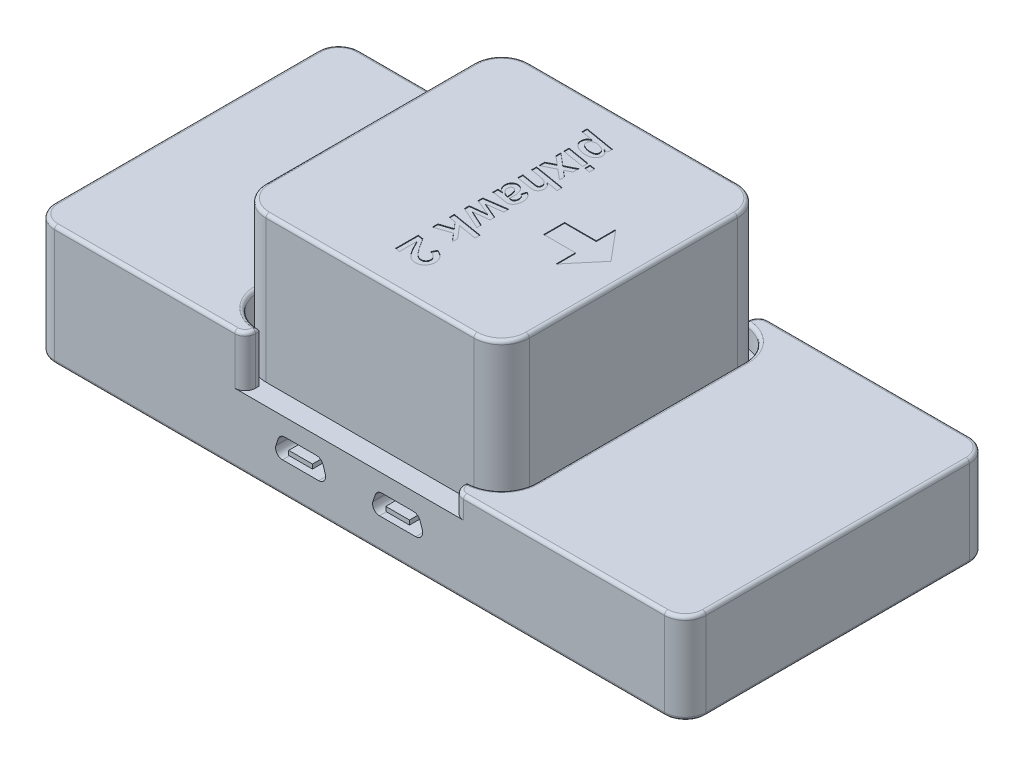
from build123d import *

# Parameters (mm, degrees)
BOSS_EXTRUDE1_DEPTH = 10
BOSS_EXTRUDE2_DEPTH = 3.1
BOSS_EXTRUDE3_DEPTH = 7.3
FILLET1_R           = 1.5
BOSS_EXTRUDE4_DEPTH = 21
FILLET2_R           = 0.5
SKETCH6_W           = 0.75
SKETCH6_H           = 0.75
CUT_EXTRUDE1_DEPTH  = 8
SKETCH7_W           = 4.55848156
SKETCH7_H           = 0.818087622
CUT_EXTRUDE2_DEPTH  = 5
SKETCH8_W           = 3.423616374
SKETCH8_H           = 0.632455532
CUT_EXTRUDE3_DEPTH  = 5
CUT_EXTRUDE4_DEPTH  = 0.1
SKETCH10_R          = 1.25
CUT_EXTRUDE5_DEPTH  = 4


with BuildPart() as part:
    # Sketch1 → Boss-Extrude1 (new body)
    with BuildSketch(Plane(origin=(0, 0, 0), x_dir=(1, 0, 0), z_dir=(0, 1, 0))):
        with BuildLine():
            Line((-44, 22), (44, 22))
            ThreePointArc((44, 22), (46.121320344, 21.121320344), (47, 19))
            Line((47, 19), (47, -19))
            ThreePointArc((47, -19), (46.121320344, -21.121320344), (44, -22))
            Line((44, -22), (-44, -22))
            ThreePointArc((-44, -22), (-46.121320344, -21.121320344), (-47, -19))
            Line((-47, -19), (-47, 19))
            ThreePointArc((-47, 19), (-46.121320344, 21.121320344), (-44, 22))
        make_face()
    extrude(amount=BOSS_EXTRUDE1_DEPTH)

    # Sketch3 → Boss-Extrude2 (add)
    with BuildSketch(Plane(origin=(0, 10, 0), x_dir=(1, 0, 0), z_dir=(0, 1, 0))):
        with BuildLine():
            Line((18.5, 15), (18.5, -15))
            ThreePointArc((18.5, -15), (17.035533906, -18.535533906), (13.5, -20))
            Line((13.5, -20), (13.5, -22))
            Line((13.5, -22), (44, -22))
            ThreePointArc((44, -22), (46.121320344, -21.121320344), (47, -19))
            Line((47, -19), (47, 19))
            ThreePointArc((47, 19), (46.121320344, 21.121320344), (44, 22))
            Line((44, 22), (13.5, 22))
            Line((13.5, 22), (13.5, 20))
            ThreePointArc((13.5, 20), (17.035533906, 18.535533906), (18.5, 15))
        make_face()
    extrude(amount=BOSS_EXTRUDE2_DEPTH)

    # Sketch4 → Boss-Extrude3 (add)
    with BuildSketch(Plane(origin=(0, 10, 0), x_dir=(1, 0, 0), z_dir=(0, 1, 0))):
        with BuildLine():
            Line((-21.5, 15), (-21.5, -15))
            ThreePointArc((-21.5, -15), (-20.035533906, -18.535533906), (-16.5, -20))
            Line((-16.5, -20), (-16.5, -22))
            Line((-16.5, -22), (-44, -22))
            ThreePointArc((-44, -22), (-46.121320344, -21.121320344), (-47, -19))
            Line((-47, -19), (-47, 19))
            ThreePointArc((-47, 19), (-46.121320344, 21.121320344), (-44, 22))
            Line((-44, 22), (-16.5, 22))
            Line((-16.5, 22), (-16.5, 20))
            ThreePointArc((-16.5, 20), (-20.035533906, 18.535533906), (-21.5, 15))
        make_face()
    extrude(amount=BOSS_EXTRUDE3_DEPTH)

    # Fillet1
    fillet1_edges = [part.edges().sort_by_distance(p)[0] for p in [
        (-16.5, 13.65, -22),
        (13.5, 11.55, -22),
        (13.5, 11.55, 22),
        (-16.5, 13.65, 22),
    ]]
    fillet(fillet1_edges, radius=FILLET1_R)

    # Sketch5 → Boss-Extrude4 (add)
    with BuildSketch(Plane(origin=(0, 10, 0), x_dir=(1, 0, 0), z_dir=(0, 1, 0))):
        with BuildLine():
            Line((-16.5, -19), (13.5, -19))
            ThreePointArc((13.5, -19), (16.328427125, -17.828427125), (17.5, -15))
            Line((17.5, -15), (17.5, 15))
            ThreePointArc((17.5, 15), (16.328427125, 17.828427125), (13.5, 19))
            Line((13.5, 19), (-16.5, 19))
            ThreePointArc((-16.5, 19), (-19.328427125, 17.828427125), (-20.5, 15))
            Line((-20.5, 15), (-20.5, -15))
            ThreePointArc((-20.5, -15), (-19.328427125, -17.828427125), (-16.5, -19))
        make_face()
    extrude(amount=BOSS_EXTRUDE4_DEPTH)

    # Fillet2
    fillet2_edges = [part.edges().sort_by_distance(p)[0] for p in [
        (0, 0, -22),
        (46.121320344, 0, -21.121320344),
        (-19.328427125, 31, 17.828427125),
        (-1.5, 31, 19),
        (16.328427125, 31, 17.828427125),
        (17.5, 31, 0),
        (16.328427125, 31, -17.828427125),
        (-1.5, 31, -19),
        (-19.328427125, 31, -17.828427125),
        (-20.5, 31, 0),
        (17.035533906, 13.1, -18.535533906),
        (18.5, 13.1, 0),
        (17.035533906, 13.1, 18.535533906),
        (13.5, 13.1, 20.25),
        (46.121320344, 13.1, 21.121320344),
        (47, 13.1, 0),
        (46.121320344, 13.1, -21.121320344),
        (29.5, 13.1, -22),
        (-20.035533906, 17.3, -18.535533906),
        (-16.5, 17.3, -20.25),
        (-46.121320344, 17.3, -21.121320344),
        (-47, 17.3, 0),
        (-46.121320344, 17.3, 21.121320344),
        (-31, 17.3, 22),
        (-20.035533906, 17.3, 18.535533906),
        (-21.5, 17.3, 0),
        (47, 0, 0),
        (-31, 17.3, -22),
        (46.121320344, 0, 21.121320344),
        (-16.5, 17.3, 20.25),
        (-16.939339828, 17.3, 21.560660172),
        (-16.939339828, 17.3, -21.560660172),
        (0, 0, 22),
        (13.5, 13.1, -20.25),
        (29.5, 13.1, 22),
        (13.939339828, 13.1, 21.560660172),
        (13.939339828, 13.1, -21.560660172),
        (-46.121320344, 0, 21.121320344),
        (-47, 0, 0),
        (-46.121320344, 0, -21.121320344),
    ]]
    fillet(fillet2_edges, radius=FILLET2_R)

    # Sketch6 → Cut-Extrude1 (cut)
    with BuildSketch(Plane.ZY.offset(47)):
        Polygon((-19, 16), (-19, 7.2), (-18, 7.2), (-18, 8), (-17, 8), (-17, 7.2), (-16, 7.2), (-16, 8), (-15, 8), (-15, 7.2), (-14, 7.2), (-14, 8), (-13, 8), (-13, 7.2), (-12, 7.2), (-12, 8), (-11, 8), (-11, 7.2), (-10, 7.2), (-10, 8), (-9, 8), (-9, 7.2), (-8, 7.2), (-8, 8), (-7, 8), (-7, 7.2), (-6, 7.2), (-6, 8), (-5, 8), (-5, 7.2), (-4, 7.2), (-4, 8), (-3, 8), (-3, 7.2), (-2, 7.2), (-2, 8), (-1, 8), (-1, 7.2), (0, 7.2), (0, 8), (1, 8), (1, 7.2), (2, 7.2), (2, 8), (3, 8), (3, 7.2), (4, 7.2), (4, 8), (5, 8), (5, 7.2), (6, 7.2), (6, 8), (7, 8), (7, 7.2), (8, 7.2), (8, 8), (9, 8), (9, 7.2), (10, 7.2), (10, 8), (11, 8), (11, 7.2), (12, 7.2), (12, 8), (13, 8), (13, 7.2), (14, 7.2), (14, 8), (15, 8), (15, 7.2), (16, 7.2), (16, 8), (17, 8), (17, 7.2), (18, 7.2), (18, 8), (19, 8), (19, 16), (17, 16), (15, 16), (13, 16), (11, 16), (9, 16), (7, 16), (5, 16), (3, 16), (1, 16), (-1, 16), (-3, 16), (-5, 16), (-7, 16), (-9, 16), (-11, 16), (-13, 16), (-15, 16), (-17, 16), align=None)
        with Locations((-18, 14.5)):
            Rectangle(SKETCH6_W, SKETCH6_H, mode=Mode.SUBTRACT)
        with Locations((-18, 12)):
            Rectangle(SKETCH6_W, SKETCH6_H, mode=Mode.SUBTRACT)
        with Locations((-18, 9.5)):
            Rectangle(SKETCH6_W, SKETCH6_H, mode=Mode.SUBTRACT)
        with Locations((-16, 14.5)):
            Rectangle(SKETCH6_W, SKETCH6_H, mode=Mode.SUBTRACT)
        with Locations((-16, 12)):
            Rectangle(SKETCH6_W, SKETCH6_H, mode=Mode.SUBTRACT)
        with Locations((-16, 9.5)):
            Rectangle(SKETCH6_W, SKETCH6_H, mode=Mode.SUBTRACT)
        with Locations((-14, 14.5)):
            Rectangle(SKETCH6_W, SKETCH6_H, mode=Mode.SUBTRACT)
        with Locations((-14, 12)):
            Rectangle(SKETCH6_W, SKETCH6_H, mode=Mode.SUBTRACT)
        with Locations((-14, 9.5)):
            Rectangle(SKETCH6_W, SKETCH6_H, mode=Mode.SUBTRACT)
        with Locations((-12, 14.5)):
            Rectangle(SKETCH6_W, SKETCH6_H, mode=Mode.SUBTRACT)
        with Locations((-12, 12)):
            Rectangle(SKETCH6_W, SKETCH6_H, mode=Mode.SUBTRACT)
        with Locations((-12, 9.5)):
            Rectangle(SKETCH6_W, SKETCH6_H, mode=Mode.SUBTRACT)
        with Locations((-10, 14.5)):
            Rectangle(SKETCH6_W, SKETCH6_H, mode=Mode.SUBTRACT)
        with Locations((-10, 12)):
            Rectangle(SKETCH6_W, SKETCH6_H, mode=Mode.SUBTRACT)
        with Locations((-10, 9.5)):
            Rectangle(SKETCH6_W, SKETCH6_H, mode=Mode.SUBTRACT)
        with Locations((-8, 14.5)):
            Rectangle(SKETCH6_W, SKETCH6_H, mode=Mode.SUBTRACT)
        with Locations((-8, 12)):
            Rectangle(SKETCH6_W, SKETCH6_H, mode=Mode.SUBTRACT)
        with Locations((-8, 9.5)):
            Rectangle(SKETCH6_W, SKETCH6_H, mode=Mode.SUBTRACT)
        with Locations((-6, 14.5)):
            Rectangle(SKETCH6_W, SKETCH6_H, mode=Mode.SUBTRACT)
        with Locations((-6, 12)):
            Rectangle(SKETCH6_W, SKETCH6_H, mode=Mode.SUBTRACT)
        with Locations((-6, 9.5)):
            Rectangle(SKETCH6_W, SKETCH6_H, mode=Mode.SUBTRACT)
        with Locations((-4, 14.5)):
            Rectangle(SKETCH6_W, SKETCH6_H, mode=Mode.SUBTRACT)
        with Locations((-4, 12)):
            Rectangle(SKETCH6_W, SKETCH6_H, mode=Mode.SUBTRACT)
        with Locations((-4, 9.5)):
            Rectangle(SKETCH6_W, SKETCH6_H, mode=Mode.SUBTRACT)
        with Locations((-2, 14.5)):
            Rectangle(SKETCH6_W, SKETCH6_H, mode=Mode.SUBTRACT)
        with Locations((-2, 12)):
            Rectangle(SKETCH6_W, SKETCH6_H, mode=Mode.SUBTRACT)
        with Locations((-2, 9.5)):
            Rectangle(SKETCH6_W, SKETCH6_H, mode=Mode.SUBTRACT)
        with Locations((0, 14.5)):
            Rectangle(SKETCH6_W, SKETCH6_H, mode=Mode.SUBTRACT)
        with Locations((0, 12)):
            Rectangle(SKETCH6_W, SKETCH6_H, mode=Mode.SUBTRACT)
        with Locations((0, 9.5)):
            Rectangle(SKETCH6_W, SKETCH6_H, mode=Mode.SUBTRACT)
        with Locations((2, 14.5)):
            Rectangle(SKETCH6_W, SKETCH6_H, mode=Mode.SUBTRACT)
        with Locations((2, 12)):
            Rectangle(SKETCH6_W, SKETCH6_H, mode=Mode.SUBTRACT)
        with Locations((2, 9.5)):
            Rectangle(SKETCH6_W, SKETCH6_H, mode=Mode.SUBTRACT)
        with Locations((4, 14.5)):
            Rectangle(SKETCH6_W, SKETCH6_H, mode=Mode.SUBTRACT)
        with Locations((4, 12)):
            Rectangle(SKETCH6_W, SKETCH6_H, mode=Mode.SUBTRACT)
        with Locations((4, 9.5)):
            Rectangle(SKETCH6_W, SKETCH6_H, mode=Mode.SUBTRACT)
        with Locations((6, 14.5)):
            Rectangle(SKETCH6_W, SKETCH6_H, mode=Mode.SUBTRACT)
        with Locations((6, 12)):
            Rectangle(SKETCH6_W, SKETCH6_H, mode=Mode.SUBTRACT)
        with Locations((6, 9.5)):
            Rectangle(SKETCH6_W, SKETCH6_H, mode=Mode.SUBTRACT)
        with Locations((8, 14.5)):
            Rectangle(SKETCH6_W, SKETCH6_H, mode=Mode.SUBTRACT)
        with Locations((8, 12)):
            Rectangle(SKETCH6_W, SKETCH6_H, mode=Mode.SUBTRACT)
        with Locations((8, 9.5)):
            Rectangle(SKETCH6_W, SKETCH6_H, mode=Mode.SUBTRACT)
        with Locations((10, 14.5)):
            Rectangle(SKETCH6_W, SKETCH6_H, mode=Mode.SUBTRACT)
        with Locations((10, 12)):
            Rectangle(SKETCH6_W, SKETCH6_H, mode=Mode.SUBTRACT)
        with Locations((10, 9.5)):
            Rectangle(SKETCH6_W, SKETCH6_H, mode=Mode.SUBTRACT)
        with Locations((12, 14.5)):
            Rectangle(SKETCH6_W, SKETCH6_H, mode=Mode.SUBTRACT)
        with Locations((12, 12)):
            Rectangle(SKETCH6_W, SKETCH6_H, mode=Mode.SUBTRACT)
        with Locations((12, 9.5)):
            Rectangle(SKETCH6_W, SKETCH6_H, mode=Mode.SUBTRACT)
        with Locations((14, 14.5)):
            Rectangle(SKETCH6_W, SKETCH6_H, mode=Mode.SUBTRACT)
        with Locations((14, 12)):
            Rectangle(SKETCH6_W, SKETCH6_H, mode=Mode.SUBTRACT)
        with Locations((14, 9.5)):
            Rectangle(SKETCH6_W, SKETCH6_H, mode=Mode.SUBTRACT)
        with Locations((16, 14.5)):
            Rectangle(SKETCH6_W, SKETCH6_H, mode=Mode.SUBTRACT)
        with Locations((16, 12)):
            Rectangle(SKETCH6_W, SKETCH6_H, mode=Mode.SUBTRACT)
        with Locations((16, 9.5)):
            Rectangle(SKETCH6_W, SKETCH6_H, mode=Mode.SUBTRACT)
        with Locations((18, 14.5)):
            Rectangle(SKETCH6_W, SKETCH6_H, mode=Mode.SUBTRACT)
        with Locations((18, 12)):
            Rectangle(SKETCH6_W, SKETCH6_H, mode=Mode.SUBTRACT)
        with Locations((18, 9.5)):
            Rectangle(SKETCH6_W, SKETCH6_H, mode=Mode.SUBTRACT)
    extrude(amount=-CUT_EXTRUDE1_DEPTH, mode=Mode.SUBTRACT)

    # Sketch7 → Cut-Extrude2 (cut)
    with BuildSketch(Plane(origin=(0, 0, -19), x_dir=(-1, 0, 0), z_dir=(0, 0, -1))):
        with BuildLine():
            Line((3.77924078, 14), (-0.77924078, 14))
            ThreePointArc((-0.77924078, 14), (-1.363951065, 14.188757815), (-1.727924078, 14.683772234))
            Line((-1.727924078, 14.683772234), (-2.061257411, 15.683772234))
            ThreePointArc((-2.061257411, 15.683772234), (-1.923816298, 16.584710285), (-1.112574113, 17))
            Line((-1.112574113, 17), (4.112574113, 17))
            ThreePointArc((4.112574113, 17), (4.923816298, 16.584710285), (5.061257411, 15.683772234))
            Line((5.061257411, 15.683772234), (4.727924078, 14.683772234))
            ThreePointArc((4.727924078, 14.683772234), (4.363951065, 14.188757815), (3.77924078, 14))
        make_face()
        with Locations((1.5, 15.2670152)):
            Rectangle(SKETCH7_W, SKETCH7_H, mode=Mode.SUBTRACT)
    extrude(amount=-CUT_EXTRUDE2_DEPTH, mode=Mode.SUBTRACT)

    # Sketch8 → Cut-Extrude3 (cut)
    # profile 1 of 2: a face of its own
    with BuildSketch(Plane.XY.offset(22)):
        with BuildLine():
            Line((-6.22075922, 7.5), (-10.77924078, 7.5))
            ThreePointArc((-10.77924078, 7.5), (-11.363951065, 7.311242185), (-11.727924078, 6.816227766))
            Line((-11.727924078, 6.816227766), (-12.061257411, 5.816227766))
            ThreePointArc((-12.061257411, 5.816227766), (-11.923816298, 4.915289715), (-11.112574113, 4.5))
            Line((-11.112574113, 4.5), (-5.887425887, 4.5))
            ThreePointArc((-5.887425887, 4.5), (-5.076183702, 4.915289715), (-4.938742589, 5.816227766))
            Line((-4.938742589, 5.816227766), (-5.272075922, 6.816227766))
            ThreePointArc((-5.272075922, 6.816227766), (-5.636048935, 7.311242185), (-6.22075922, 7.5))
        make_face()
        with Locations((-8.5, 5.816227766)):
            Rectangle(SKETCH8_W, SKETCH8_H, mode=Mode.SUBTRACT)
    # profile 2 of 2: a face of its own
    with BuildSketch(Plane.XY.offset(22)):
        with BuildLine():
            Line((2.272075922, 6.816227766), (1.938742589, 5.816227766))
            ThreePointArc((1.938742589, 5.816227766), (2.076183702, 4.915289715), (2.887425887, 4.5))
            Line((2.887425887, 4.5), (8.112574113, 4.5))
            ThreePointArc((8.112574113, 4.5), (8.923816298, 4.915289715), (9.061257411, 5.816227766))
            Line((9.061257411, 5.816227766), (8.727924078, 6.816227766))
            ThreePointArc((8.727924078, 6.816227766), (8.363951065, 7.311242185), (7.77924078, 7.5))
            Line((7.77924078, 7.5), (3.22075922, 7.5))
            ThreePointArc((3.22075922, 7.5), (2.636048935, 7.311242185), (2.272075922, 6.816227766))
        make_face()
        with Locations((5.5, 5.816227766)):
            Rectangle(SKETCH8_W, SKETCH8_H, mode=Mode.SUBTRACT)
    extrude(amount=-CUT_EXTRUDE3_DEPTH, mode=Mode.SUBTRACT)

    # Sketch9 → Cut-Extrude4 (cut)
    # profile 1 of 10: a face of its own
    with BuildSketch(Plane(origin=(0, 31, 0), x_dir=(1, 0, 0), z_dir=(0, 1, 0))):
        Polygon((14.278659866, 0), (10.656792996, 4.316372855), (10.656792996, 1.5), (6.089467314, 1.5), (6.089467314, -1.5), (10.656792996, -1.5), (10.656792996, -4.316372855), align=None)
    # profile 2 of 10: a face of its own
    with BuildSketch(Plane(origin=(0, 31, 0), x_dir=(1, 0, 0), z_dir=(0, 1, 0))):
        with BuildLine():
            Line((-3.987484441, 14.100467933), (-3.987484441, 14.828964326))
            Line((-3.987484441, 14.828964326), (0.397002456, 14.085994495))
            Line((0.397002456, 14.085994495), (0.397002456, 13.420216335))
            Line((0.397002456, 13.420216335), (-0.295792788, 13.537933633))
            add(Edge.make_bspline(
                [(-0.295792788, 13.537933633), (-0.231453657, 13.503682228), (-0.108184623, 13.438059063), (0.058909692, 13.32567937), (0.201299382, 13.207262183), (0.317948782, 13.081211697), (0.408142459, 12.947696459), (0.472939852, 12.807787971), (0.513740713, 12.660880785), (0.518241979, 12.560109868), (0.52050913, 12.50935462)],
                knots=[0, 0, 0, 0, 1.261498847, 2.416938787, 3.480176131, 4.461740898, 5.380832901, 6.257997024, 7.122606052, 8, 8, 8, 8], degree=3))
            add(Edge.make_bspline(
                [(0.52050913, 12.50935462), (0.519446385, 12.471333166), (0.517363307, 12.39680762), (0.499542126, 12.288003054), (0.470491432, 12.184696444), (0.429795216, 12.086814268), (0.377470372, 11.994074175), (0.311719122, 11.908279398), (0.236337071, 11.826562387), (0.149462614, 11.751705567), (0.052837835, 11.684090373), (-0.052951901, 11.625142482), (-0.166674576, 11.575098059), (-0.288527096, 11.534543369), (-0.418171796, 11.502492098), (-0.556384173, 11.481028407), (-0.702375324, 11.467155088), (-0.802330046, 11.465314619), (-0.85350261, 11.464372377)],
                knots=[0, 0, 0, 0, 0.941970943, 1.846349639, 2.724628806, 3.596698408, 4.467892951, 5.356031433, 6.269918392, 7.219416619, 8.192584869, 9.188414247, 10.21646559, 11.267778751, 12.368013318, 13.522733717, 14.7317451, 16, 16, 16, 16], degree=3))
            add(Edge.make_bspline(
                [(-0.85350261, 11.464372377), (-0.918194471, 11.465398917), (-1.046556642, 11.467435786), (-1.236768166, 11.486339355), (-1.422823464, 11.517040461), (-1.604482047, 11.560905371), (-1.782362562, 11.615540081), (-1.955791013, 11.683472842), (-2.124666898, 11.764118475), (-2.288166607, 11.853933956), (-2.439110444, 11.954307721), (-2.571914953, 12.064100413), (-2.684927683, 12.181110201), (-2.778011668, 12.30619162), (-2.848944967, 12.440216012), (-2.900833342, 12.580869081), (-2.931341166, 12.729660159), (-2.935542239, 12.831170039), (-2.937677719, 12.882769327)],
                knots=[0, 0, 0, 0, 1.116727311, 2.215820355, 3.296777593, 4.37030568, 5.440034981, 6.50739762, 7.583006455, 8.669342543, 9.725945833, 10.707890216, 11.638757248, 12.528443272, 13.39052447, 14.2478705, 15.109361226, 16, 16, 16, 16], degree=3))
            add(Edge.make_bspline(
                [(-2.937677719, 12.882769327), (-2.935798395, 12.937301252), (-2.932149666, 13.043175627), (-2.899456239, 13.19476041), (-2.847688789, 13.333740555), (-2.771709088, 13.457476204), (-2.676121794, 13.568821523), (-2.556708727, 13.662933305), (-2.418870219, 13.746702432), (-2.315738805, 13.78713466), (-2.2622506, 13.80810448)],
                knots=[0, 0, 0, 0, 1.060630692, 2.059226998, 3.004807098, 3.934934718, 4.871680154, 5.846828231, 6.883276337, 8, 8, 8, 8], degree=3))
            Line((-2.2622506, 13.80810448), (-3.987484441, 14.100467933))
        make_face()
        with BuildLine():
            add(Edge.make_bspline(
                [(-2.320144354, 13.019784543), (-2.31906498, 12.988116026), (-2.316933124, 12.925567986), (-2.293363711, 12.83513287), (-2.257693706, 12.749790647), (-2.206436878, 12.670756888), (-2.140856764, 12.597726359), (-2.060487592, 12.531436211), (-1.96715813, 12.468830388), (-1.823227662, 12.39654382), (-1.632543402, 12.320544218), (-1.396689029, 12.25473852), (-1.157614718, 12.213326846), (-0.99679256, 12.208054071), (-0.916220842, 12.205412416)],
                knots=[0, 0, 0, 0, 0.639127482, 1.262331674, 1.877333655, 2.503484616, 3.157695573, 3.854838522, 4.605385696, 5.425858387, 7.107357241, 8.748831193, 10.371168137, 12, 12, 12, 12], degree=3))
            add(Edge.make_bspline(
                [(-0.916220842, 12.205412416), (-0.88307117, 12.205610189), (-0.818948527, 12.205992749), (-0.726039702, 12.213822155), (-0.639342766, 12.221781383), (-0.55953415, 12.238699051), (-0.485482583, 12.255559601), (-0.418311013, 12.279472012), (-0.356918314, 12.306122983), (-0.302318593, 12.337714539), (-0.253863262, 12.373345482), (-0.210923228, 12.412234859), (-0.176334259, 12.457656753), (-0.146807675, 12.505899271), (-0.124824929, 12.558768924), (-0.108045672, 12.615267466), (-0.098402789, 12.676271842), (-0.097491365, 12.7183821), (-0.097024236, 12.739964736)],
                knots=[0, 0, 0, 0, 1.435559759, 2.776856611, 4.038710643, 5.202916836, 6.308082838, 7.32608991, 8.286786172, 9.204583877, 10.051863807, 10.889926384, 11.703893209, 12.516427414, 13.334321008, 14.176543877, 15.065429821, 16, 16, 16, 16], degree=3))
            add(Edge.make_bspline(
                [(-0.097024236, 12.739964736), (-0.098687905, 12.772864305), (-0.102000635, 12.838374602), (-0.123098196, 12.934536141), (-0.161221049, 13.025792254), (-0.212447314, 13.11313751), (-0.279683983, 13.195974253), (-0.360536501, 13.274783082), (-0.456977015, 13.348539217), (-0.565116882, 13.417323272), (-0.68122649, 13.479803526), (-0.800508733, 13.535080045), (-0.921177328, 13.582608217), (-1.043579642, 13.621456204), (-1.167941874, 13.65018567), (-1.293599008, 13.671273813), (-1.420845132, 13.685777336), (-1.506375771, 13.686920317), (-1.549192542, 13.687492495)],
                knots=[0, 0, 0, 0, 0.833056023, 1.658798261, 2.476796725, 3.327219383, 4.213524387, 5.169324243, 6.179089722, 7.281299713, 8.410692177, 9.514494936, 10.607675836, 11.691813598, 12.762258901, 13.835796373, 14.916596293, 16, 16, 16, 16], degree=3))
            add(Edge.make_bspline(
                [(-1.549192542, 13.687492495), (-1.578168433, 13.687039337), (-1.635003478, 13.686150486), (-1.717600805, 13.676216441), (-1.795678784, 13.660736982), (-1.868794102, 13.639845754), (-1.937456402, 13.612586729), (-2.001002532, 13.578678137), (-2.060653475, 13.539119832), (-2.130728136, 13.47792129), (-2.207260838, 13.394298265), (-2.271606731, 13.27809992), (-2.313905191, 13.152613085), (-2.318043388, 13.064513014), (-2.320144354, 13.019784543)],
                knots=[0, 0, 0, 0, 0.912891304, 1.790599611, 2.617669246, 3.419758295, 4.184055822, 4.941396756, 5.686493576, 6.43420647, 7.870458793, 9.232260465, 10.594816598, 12, 12, 12, 12], degree=3))
        make_face(mode=Mode.SUBTRACT)
    # profile 3 of 10: a face of its own
    with BuildSketch(Plane(origin=(0, 31, 0), x_dir=(1, 0, 0), z_dir=(0, 1, 0))):
        Polygon((0.767522476, 9.734314057), (0.767522476, 10.500441389), (1.570315852, 10.365355965), (1.570315852, 9.599228633), align=None)
    # profile 4 of 10: a face of its own
    with BuildSketch(Plane(origin=(0, 31, 0), x_dir=(1, 0, 0), z_dir=(0, 1, 0))):
        Polygon((-2.875924383, 10.345093152), (-2.875924383, 11.109290692), (0.397002456, 10.562194726), (0.397002456, 9.797997185), align=None)
    # profile 5 of 10: a face of its own
    with BuildSketch(Plane(origin=(0, 31, 0), x_dir=(1, 0, 0), z_dir=(0, 1, 0))):
        Polygon((-2.875924383, 6.771118797), (-2.875924383, 7.603823945), (-1.679453486, 8.202059393), (-2.875924383, 9.21327028), (-2.875924383, 9.93983688), (-1.139111791, 8.472230241), (0.397002456, 9.24125226), (0.397002456, 8.408547112), (-0.521578425, 7.949256671), (0.397002456, 7.172515484), (0.397002456, 6.44691378), (-1.061920121, 7.679085824), align=None)
    # profile 6 of 10: a face of its own
    with BuildSketch(Plane(origin=(0, 31, 0), x_dir=(1, 0, 0), z_dir=(0, 1, 0))):
        with BuildLine():
            Line((-2.875924383, 3.712398844), (-2.875924383, 4.43993034))
            Line((-2.875924383, 4.43993034), (-0.985693346, 4.124409386))
            add(Edge.make_bspline(
                [(-0.985693346, 4.124409386), (-0.959653784, 4.11982975), (-0.909866341, 4.111073521), (-0.839363476, 4.099897661), (-0.776727767, 4.089656269), (-0.722216673, 4.082738459), (-0.675481184, 4.074804835), (-0.636699183, 4.071928478), (-0.605908282, 4.068200713), (-0.588163639, 4.067698993), (-0.580437074, 4.067480529)],
                knots=[0, 0, 0, 0, 1.549606308, 2.962835416, 4.183966133, 5.269029581, 6.183469928, 6.960048383, 7.547172991, 8, 8, 8, 8], degree=3))
            add(Edge.make_bspline(
                [(-0.580437074, 4.067480529), (-0.547501877, 4.068592018), (-0.485109247, 4.070697629), (-0.398165023, 4.091189326), (-0.322959009, 4.123792119), (-0.261923538, 4.172309829), (-0.213728914, 4.234289035), (-0.181487007, 4.310406031), (-0.16223426, 4.39909636), (-0.159975942, 4.462336263), (-0.158777573, 4.495894302)],
                knots=[0, 0, 0, 0, 1.145435513, 2.169919679, 3.09248482, 3.977837671, 4.856287774, 5.799306021, 6.832209241, 8, 8, 8, 8], degree=3))
            add(Edge.make_bspline(
                [(-0.158777573, 4.495894302), (-0.159516045, 4.520381802), (-0.160981942, 4.568990469), (-0.172971654, 4.641573938), (-0.193479425, 4.712925492), (-0.221627079, 4.783703189), (-0.257673172, 4.853369118), (-0.30123281, 4.922415544), (-0.353923552, 4.989616493), (-0.413536461, 5.057071932), (-0.484349259, 5.120948424), (-0.567389705, 5.18035597), (-0.663459294, 5.233929911), (-0.771988256, 5.28303434), (-0.893037401, 5.327107293), (-1.026363375, 5.366718454), (-1.172557277, 5.399971781), (-1.274441199, 5.418419078), (-1.327266489, 5.427983726)],
                knots=[0, 0, 0, 0, 0.719827964, 1.428887327, 2.156441309, 2.899386918, 3.665044384, 4.460106855, 5.296300213, 6.173684546, 7.104501426, 8.094061489, 9.169860714, 10.333850251, 11.59365571, 12.955293849, 14.421365427, 16, 16, 16, 16], degree=3))
            Line((-1.327266489, 5.427983726), (-2.875924383, 5.688505615))
            Line((-2.875924383, 5.688505615), (-2.875924383, 6.416037111))
            Line((-2.875924383, 6.416037111), (1.570315852, 5.67306728))
            Line((1.570315852, 5.67306728), (1.570315852, 4.945535784))
            Line((1.570315852, 4.945535784), (-0.21570643, 5.243688612))
            add(Edge.make_bspline(
                [(-0.21570643, 5.243688612), (-0.162186205, 5.20939588), (-0.058799757, 5.143151694), (0.078614575, 5.029419518), (0.19589392, 4.910652903), (0.291309851, 4.785044892), (0.367540157, 4.654048306), (0.419241915, 4.515256151), (0.452916835, 4.37109872), (0.456797815, 4.272548132), (0.458755793, 4.222828767)],
                knots=[0, 0, 0, 0, 1.18900067, 2.296824362, 3.331481453, 4.306909765, 5.242674338, 6.157398121, 7.070396251, 8, 8, 8, 8], degree=3))
            add(Edge.make_bspline(
                [(0.458755793, 4.222828767), (0.45840529, 4.191913928), (0.45771666, 4.131175911), (0.446166458, 4.041927583), (0.430169888, 3.956432805), (0.408126476, 3.874139949), (0.377775403, 3.795875451), (0.341435652, 3.720907447), (0.298334026, 3.649629148), (0.249527683, 3.582354796), (0.194014062, 3.519551932), (0.128378599, 3.466908815), (0.056642599, 3.420663963), (-0.023529855, 3.384320646), (-0.110738255, 3.355014346), (-0.205697998, 3.335557988), (-0.307963229, 3.322316486), (-0.378727282, 3.321219984), (-0.415439878, 3.320651115)],
                knots=[0, 0, 0, 0, 1.039889856, 2.04305932, 3.024074512, 3.967009926, 4.906021226, 5.845406958, 6.768237509, 7.705937122, 8.64107052, 9.579582347, 10.528713198, 11.507215876, 12.534345864, 13.619469254, 14.76497377, 16, 16, 16, 16], degree=3))
            add(Edge.make_bspline(
                [(-0.415439878, 3.320651115), (-0.427671086, 3.32080688), (-0.455400427, 3.321160015), (-0.501304793, 3.326003217), (-0.556432157, 3.330075744), (-0.620433387, 3.338188865), (-0.693278537, 3.349298657), (-0.775494391, 3.360188522), (-0.866072831, 3.37517587), (-0.929407894, 3.385623691), (-0.962535844, 3.391088514)],
                knots=[0, 0, 0, 0, 0.53156046, 1.205099444, 2.00522489, 2.934897165, 4.008724139, 5.209115947, 6.540204076, 8, 8, 8, 8], degree=3))
            Line((-0.962535844, 3.391088514), (-2.875924383, 3.712398844))
        make_face()
    # profile 7 of 10: a face of its own
    with BuildSketch(Plane(origin=(0, 31, 0), x_dir=(1, 0, 0), z_dir=(0, 1, 0))):
        with BuildLine():
            Line((-2.875924383, 0.089214799), (-2.875924383, 0.836044213))
            add(Edge.make_bspline(
                [(-2.875924383, 0.836044213), (-2.849238997, 0.837874799), (-2.801362584, 0.841159064), (-2.753388954, 0.842295483), (-2.732154896, 0.842798484)],
                knots=[0, 0, 0, 0, 1.114761245, 2, 2, 2, 2], degree=3))
            add(Edge.make_bspline(
                [(-2.732154896, 0.842798484), (-2.69064695, 0.841900635), (-2.603333217, 0.84001197), (-2.466797435, 0.828961094), (-2.318405513, 0.810499057), (-2.216193079, 0.793045689), (-2.162866324, 0.783939835)],
                knots=[0, 0, 0, 0, 0.869332553, 1.828678081, 2.867167654, 4, 4, 4, 4], degree=3))
            add(Edge.make_bspline(
                [(-2.162866324, 0.783939835), (-2.221886809, 0.812039034), (-2.337183916, 0.866931099), (-2.493407654, 0.972908431), (-2.627048129, 1.098196628), (-2.739263879, 1.238787058), (-2.827209638, 1.393127131), (-2.891407245, 1.555747478), (-2.930775651, 1.726712909), (-2.935355324, 1.843188368), (-2.937677719, 1.902254165)],
                knots=[0, 0, 0, 0, 1.085713933, 2.120953026, 3.123526653, 4.120652363, 5.100275414, 6.065460536, 7.018976904, 8, 8, 8, 8], degree=3))
            add(Edge.make_bspline(
                [(-2.937677719, 1.902254165), (-2.937069245, 1.93767599), (-2.935881392, 2.006825874), (-2.922730815, 2.107831653), (-2.902610309, 2.203715427), (-2.874870213, 2.295100545), (-2.837719113, 2.381133469), (-2.793674595, 2.462821872), (-2.739814331, 2.538286191), (-2.679412911, 2.608396618), (-2.612854037, 2.672060299), (-2.541964403, 2.727993752), (-2.466422833, 2.774950042), (-2.387539384, 2.813415743), (-2.304818, 2.843826426), (-2.218321755, 2.864532166), (-2.12829838, 2.879083259), (-2.066758528, 2.880127952), (-2.035500068, 2.880658592)],
                knots=[0, 0, 0, 0, 1.140923943, 2.227292263, 3.276277673, 4.295919007, 5.298988339, 6.291667912, 7.280932385, 8.280407149, 9.270105939, 10.244653848, 11.185148044, 12.130825634, 13.068631472, 14.01889907, 14.993722548, 16, 16, 16, 16], degree=3))
            add(Edge.make_bspline(
                [(-2.035500068, 2.880658592), (-1.992609814, 2.879255065), (-1.908430778, 2.876500418), (-1.786176398, 2.852498468), (-1.670538622, 2.814725907), (-1.561685909, 2.761198957), (-1.459573726, 2.691882437), (-1.364431749, 2.607039412), (-1.276701512, 2.506783786), (-1.19509918, 2.39200967), (-1.121140988, 2.261226675), (-1.059612472, 2.112321033), (-1.004725442, 1.947509514), (-0.962908693, 1.764719068), (-0.927547227, 1.565496878), (-0.904490342, 1.348847839), (-0.889754742, 1.115106705), (-0.888119959, 0.953464644), (-0.887273965, 0.869815569)],
                knots=[0, 0, 0, 0, 0.79484378, 1.560009057, 2.301387339, 3.045735746, 3.801871518, 4.583623495, 5.403525375, 6.267594815, 7.19178334, 8.183454721, 9.251193574, 10.410188063, 11.65770248, 13.002268198, 14.448686605, 16, 16, 16, 16], degree=3))
            add(Edge.make_bspline(
                [(-0.887273965, 0.869815569), (-0.887821645, 0.821554619), (-0.889005553, 0.717229802), (-0.896038257, 0.613131462), (-0.899817612, 0.557189302)],
                knots=[0, 0, 0, 0, 0.925205544, 2, 2, 2, 2], degree=3))
            add(Edge.make_bspline(
                [(-0.899817612, 0.557189302), (-0.875377137, 0.553960952), (-0.829106218, 0.54784901), (-0.76392695, 0.539428646), (-0.706552104, 0.535843915), (-0.671139297, 0.534605504), (-0.654734057, 0.534031801)],
                knots=[0, 0, 0, 0, 1.201025736, 2.273792282, 3.20032175, 4, 4, 4, 4], degree=3))
            add(Edge.make_bspline(
                [(-0.654734057, 0.534031801), (-0.616196206, 0.536115378), (-0.5423014, 0.540110555), (-0.438520179, 0.574590559), (-0.350680101, 0.633725208), (-0.280054969, 0.714710114), (-0.226150865, 0.811687107), (-0.186082707, 0.920000628), (-0.162806128, 1.039617333), (-0.160154269, 1.122836093), (-0.158777573, 1.166038605)],
                knots=[0, 0, 0, 0, 1.021073586, 1.957868208, 2.862363448, 3.799624756, 4.782287884, 5.792489705, 6.853984467, 8, 8, 8, 8], degree=3))
            add(Edge.make_bspline(
                [(-0.158777573, 1.166038605), (-0.159953389, 1.20761693), (-0.162248538, 1.28877623), (-0.18360782, 1.406122816), (-0.219943271, 1.514653443), (-0.268877438, 1.615054843), (-0.333742897, 1.705992631), (-0.412911755, 1.787244551), (-0.505358051, 1.860897565), (-0.575317637, 1.900308957), (-0.611313743, 1.920587187)],
                knots=[0, 0, 0, 0, 1.071934182, 2.09237458, 3.063201199, 4.016856354, 4.963082905, 5.931317666, 6.935606801, 8, 8, 8, 8], degree=3))
            Line((-0.611313743, 1.920587187), (-0.405790919, 2.571891909))
            add(Edge.make_bspline(
                [(-0.405790919, 2.571891909), (-0.370494699, 2.554326136), (-0.301361476, 2.519920795), (-0.202975094, 2.461333792), (-0.111426996, 2.398172395), (-0.027161818, 2.328828054), (0.051369864, 2.256101889), (0.121817786, 2.176949286), (0.18703155, 2.094479349), (0.243663708, 2.00567051), (0.295470221, 1.91339359), (0.33853976, 1.814807385), (0.376507427, 1.712252686), (0.405966742, 1.603915496), (0.430608086, 1.491647974), (0.446183537, 1.373817408), (0.457728746, 1.251501033), (0.458409458, 1.167997941), (0.458755793, 1.125512978)],
                knots=[0, 0, 0, 0, 1.056253982, 2.068840281, 3.065899731, 4.03380825, 4.991182078, 5.931051881, 6.870724044, 7.805521144, 8.750711565, 9.70376876, 10.685396351, 11.678760557, 12.70999468, 13.763184548, 14.861946094, 16, 16, 16, 16], degree=3))
            add(Edge.make_bspline(
                [(0.458755793, 1.125512978), (0.458250437, 1.075299848), (0.457266884, 0.977572013), (0.442837223, 0.835201918), (0.422253111, 0.700643541), (0.392527242, 0.574067337), (0.353799376, 0.455590735), (0.306748501, 0.345237819), (0.250387459, 0.243149148), (0.185917816, 0.149845933), (0.11486131, 0.06572821), (0.037326489, -0.007385896), (-0.046339945, -0.068307206), (-0.135058988, -0.119419711), (-0.22974344, -0.158876609), (-0.330450977, -0.187199997), (-0.436775702, -0.203529138), (-0.509622841, -0.205835466), (-0.546665718, -0.207008238)],
                knots=[0, 0, 0, 0, 1.284127887, 2.499247429, 3.657300288, 4.765056063, 5.821562781, 6.842641006, 7.829729902, 8.799831262, 9.739690905, 10.642058524, 11.519313176, 12.381777204, 13.255938837, 14.136467917, 15.052391173, 16, 16, 16, 16], degree=3))
            add(Edge.make_bspline(
                [(-0.546665718, -0.207008238), (-0.566303069, -0.206644975), (-0.612129046, -0.205797259), (-0.690499416, -0.196465205), (-0.789006337, -0.185439118), (-0.907364573, -0.168741884), (-1.045539958, -0.147025911), (-1.20399618, -0.122555684), (-1.382265017, -0.090887336), (-1.508017283, -0.068988509), (-1.574279835, -0.057449376)],
                knots=[0, 0, 0, 0, 0.453396354, 1.058051602, 1.821008398, 2.743428812, 3.818236147, 5.05176417, 6.446488206, 8, 8, 8, 8], degree=3))
            add(Edge.make_bspline(
                [(-1.574279835, -0.057449376), (-1.644035075, -0.044681098), (-1.776674302, -0.020402284), (-1.966036155, 0.010681812), (-2.134964246, 0.039598855), (-2.284317127, 0.061496551), (-2.41360833, 0.078969431), (-2.522576414, 0.092143333), (-2.611782337, 0.099057651), (-2.664605354, 0.100935123), (-2.687769685, 0.101758445)],
                knots=[0, 0, 0, 0, 1.511931649, 2.874930158, 4.091368545, 5.165928058, 6.093093943, 6.873108883, 7.505827574, 8, 8, 8, 8], degree=3))
            add(Edge.make_bspline(
                [(-2.687769685, 0.101758445), (-2.717711732, 0.101258739), (-2.780633732, 0.100208628), (-2.843154651, 0.092995493), (-2.875924383, 0.089214799)],
                knots=[0, 0, 0, 0, 0.95171947, 2, 2, 2, 2], degree=3))
        make_face()
        with BuildLine():
            add(Edge.make_bspline(
                [(-1.270337632, 0.621837327), (-1.27415866, 0.690047748), (-1.281518953, 0.821438721), (-1.297897099, 1.010316746), (-1.317819991, 1.183170823), (-1.341815685, 1.339616913), (-1.369003939, 1.47996689), (-1.401996011, 1.603516039), (-1.437225944, 1.711478256), (-1.476525674, 1.804621695), (-1.521812417, 1.883596514), (-1.569745356, 1.952613374), (-1.624623133, 2.009770547), (-1.683246125, 2.05807856), (-1.74808715, 2.093746775), (-1.816785887, 2.120289336), (-1.890567149, 2.137504274), (-1.941808761, 2.13890418), (-1.967957356, 2.139618553)],
                knots=[0, 0, 0, 0, 1.78622093, 3.440725061, 4.956398712, 6.334909189, 7.578475625, 8.692254853, 9.676234338, 10.546391981, 11.329765918, 12.053202023, 12.737294615, 13.395302325, 14.031617184, 14.662574448, 15.317511743, 16, 16, 16, 16], degree=3))
            add(Edge.make_bspline(
                [(-1.967957356, 2.139618553), (-1.992966413, 2.138015694), (-2.041762473, 2.134888299), (-2.110732715, 2.108087703), (-2.17235535, 2.065233351), (-2.224614208, 2.00549216), (-2.269255953, 1.932588869), (-2.29738343, 1.844927806), (-2.318020072, 1.746579103), (-2.319412327, 1.676597651), (-2.320144354, 1.639802485)],
                knots=[0, 0, 0, 0, 0.876383327, 1.709942696, 2.562900334, 3.491396339, 4.480148824, 5.545547752, 6.709486933, 8, 8, 8, 8], degree=3))
            add(Edge.make_bspline(
                [(-2.320144354, 1.639802485), (-2.319472386, 1.612416158), (-2.318129193, 1.557673778), (-2.305022604, 1.476155361), (-2.28386181, 1.396368587), (-2.254529941, 1.318104057), (-2.21658183, 1.241579177), (-2.170086388, 1.166563314), (-2.115875317, 1.09270266), (-2.052896308, 1.021742319), (-1.983059427, 0.952648527), (-1.903257623, 0.890564365), (-1.817021809, 0.832264767), (-1.723084472, 0.778775689), (-1.620623408, 0.732241533), (-1.510883179, 0.68942166), (-1.393638522, 0.651761243), (-1.311966497, 0.631940244), (-1.270337632, 0.621837327)],
                knots=[0, 0, 0, 0, 0.83090657, 1.660894631, 2.499340513, 3.333625348, 4.193905174, 5.088202908, 6.010010983, 6.971758717, 7.96611563, 8.987855045, 10.03594367, 11.124769339, 12.265051525, 13.449143489, 14.699808606, 16, 16, 16, 16], degree=3))
        make_face(mode=Mode.SUBTRACT)
    # profile 8 of 10: a face of its own
    with BuildSketch(Plane(origin=(0, 31, 0), x_dir=(1, 0, 0), z_dir=(0, 1, 0))):
        Polygon((-2.875924383, -3.977821353), (-2.875924383, -3.293710171), (-0.547630614, -3.015820157), (-2.875924383, -2.011363541), (-2.875924383, -1.340760902), (0.397002456, -0.870856606), (0.397002456, -1.579090185), (-1.889800789, -1.905224994), (0.397002456, -2.892313484), (0.397002456, -3.550372477), (-1.861818809, -3.819578428), (0.397002456, -4.848157441), (0.397002456, -5.471480182), align=None)
    # profile 9 of 10: a face of its own
    with BuildSketch(Plane(origin=(0, 31, 0), x_dir=(1, 0, 0), z_dir=(0, 1, 0))):
        Polygon((-2.875924383, -8.605462014), (-2.875924383, -7.819071868), (-1.109200019, -7.23723965), (-1.876292247, -6.334097102), (-2.875924383, -6.16813501), (-2.875924383, -5.440603514), (1.570315852, -6.183573345), (1.570315852, -6.911104841), (-1.110164915, -6.463393151), (0.397002456, -8.234941994), (0.397002456, -9.006858702), (-0.587191345, -7.850913432), align=None)
    # profile 10 of 10: a face of its own
    with BuildSketch(Plane(origin=(0, 31, 0), x_dir=(1, 0, 0), z_dir=(0, 1, 0))):
        with BuildLine():
            Line((-2.875924383, -13.91624896), (-2.875924383, -10.643322121))
            Line((-2.875924383, -10.643322121), (-2.096288508, -10.766828794))
            add(Edge.make_bspline(
                [(-2.096288508, -10.766828794), (-2.029971113, -10.880394273), (-1.894296378, -11.112730997), (-1.674550119, -11.463027806), (-1.44007937, -11.826744749), (-1.232442543, -12.132458855), (-1.063754269, -12.373411733), (-0.941092907, -12.540301107), (-0.82504188, -12.692373762), (-0.712465356, -12.827154332), (-0.607720199, -12.948164792), (-0.50890619, -13.054165778), (-0.413780482, -13.142551163), (-0.325386935, -13.219116676), (-0.237608124, -13.28121728), (-0.151850464, -13.336069326), (-0.064913099, -13.381369288), (0.022570912, -13.418386309), (0.110390675, -13.447285574), (0.198676843, -13.468934383), (0.287579507, -13.481899261), (0.347108303, -13.483285556), (0.376739643, -13.483975604)],
                knots=[0, 0, 0, 0, 2.076547684, 4.248282928, 6.529048246, 8.909685426, 10.083438179, 11.173416532, 12.180131091, 13.103532398, 13.945856164, 14.707514259, 15.390199284, 15.995627104, 16.55238113, 17.086433676, 17.60210574, 18.098275795, 18.584918625, 19.060408523, 19.532304425, 20, 20, 20, 20], degree=3))
            add(Edge.make_bspline(
                [(0.376739643, -13.483975604), (0.401545383, -13.483549888), (0.450069886, -13.48271711), (0.521029819, -13.472349404), (0.589112876, -13.457459739), (0.653359142, -13.434704046), (0.7154708, -13.408060713), (0.772982349, -13.372929648), (0.827405569, -13.33200622), (0.894995057, -13.270934994), (0.967248325, -13.183529786), (1.031691342, -13.064918192), (1.06932033, -12.933330772), (1.073926952, -12.841916054), (1.076289159, -12.795039943)],
                knots=[0, 0, 0, 0, 0.813701291, 1.591746493, 2.34997719, 3.097992069, 3.825987771, 4.564853653, 5.304021297, 6.059083629, 7.551718276, 9.002108364, 10.462725677, 12, 12, 12, 12], degree=3))
            add(Edge.make_bspline(
                [(1.076289159, -12.795039943), (1.075638836, -12.766687471), (1.074346412, -12.710341026), (1.061197209, -12.627300882), (1.040819782, -12.546573163), (1.01301761, -12.468075957), (0.976028656, -12.392406502), (0.930341175, -12.319940459), (0.876657195, -12.250234257), (0.816224782, -12.182552478), (0.747607655, -12.119550649), (0.673279724, -12.059595529), (0.590611852, -12.007811633), (0.503659211, -11.957266309), (0.409036925, -11.914445519), (0.307837552, -11.877130398), (0.200935782, -11.842584568), (0.126338023, -11.825408517), (0.088235773, -11.816635516)],
                knots=[0, 0, 0, 0, 0.901508109, 1.791617214, 2.667792027, 3.548259502, 4.436189201, 5.341985539, 6.269207918, 7.232983912, 8.225033522, 9.230349149, 10.26644685, 11.325093333, 12.428688938, 13.565382917, 14.756472188, 16, 16, 16, 16], degree=3))
            Line((0.088235773, -11.816635516), (0.397002456, -11.137348814))
            add(Edge.make_bspline(
                [(0.397002456, -11.137348814), (0.450631962, -11.157003737), (0.555508287, -11.19544034), (0.706202143, -11.26243859), (0.846567409, -11.336544059), (0.978141585, -11.416918218), (1.099630261, -11.50478996), (1.212052174, -11.599129451), (1.313731376, -11.701387288), (1.406283794, -11.808894181), (1.488270865, -11.922032133), (1.560221654, -12.038815584), (1.620167733, -12.160117507), (1.66930509, -12.284753765), (1.708731235, -12.412983789), (1.735017542, -12.545250833), (1.752174715, -12.681055777), (1.754433968, -12.772794744), (1.755575861, -12.81916234)],
                knots=[0, 0, 0, 0, 1.182873048, 2.313192625, 3.4128414, 4.468609496, 5.504066544, 6.515739732, 7.505009838, 8.487753008, 9.451202919, 10.39611673, 11.325687398, 12.249822984, 13.168708715, 14.100282565, 15.039826433, 16, 16, 16, 16], degree=3))
            add(Edge.make_bspline(
                [(1.755575861, -12.81916234), (1.754693398, -12.870373369), (1.752960654, -12.970927706), (1.732533179, -13.118052826), (1.702152192, -13.25903057), (1.658356079, -13.393740794), (1.602782761, -13.522410467), (1.533145784, -13.643633351), (1.452865829, -13.759540829), (1.360045376, -13.867192658), (1.258132999, -13.965195528), (1.149857931, -14.05207959), (1.034668946, -14.124340291), (0.913538311, -14.18417831), (0.786319054, -14.230244272), (0.652803166, -14.263341194), (0.513363713, -14.282766198), (0.418290811, -14.285420407), (0.369985372, -14.28676898)],
                knots=[0, 0, 0, 0, 1.089792375, 2.139838879, 3.156864966, 4.157546525, 5.151336564, 6.135950224, 7.129669454, 8.149666312, 9.157215534, 10.137029259, 11.100451453, 12.04695058, 13.008959666, 13.975760039, 14.971507125, 16, 16, 16, 16], degree=3))
            add(Edge.make_bspline(
                [(0.369985372, -14.28676898), (0.329417725, -14.286158275), (0.24872777, -14.284943568), (0.129313936, -14.271190425), (0.011860846, -14.253194289), (-0.101803531, -14.223025522), (-0.213494216, -14.188069738), (-0.321810335, -14.142914331), (-0.427949477, -14.090930061), (-0.533116819, -14.030426322), (-0.638119806, -13.957044743), (-0.742884625, -13.866369578), (-0.850412277, -13.759528112), (-0.959506282, -13.635554935), (-1.073391786, -13.496437901), (-1.187135054, -13.338531395), (-1.305075763, -13.165091587), (-1.422373488, -12.977430435), (-1.537916054, -12.783563852), (-1.649658393, -12.59078036), (-1.756375849, -12.402281485), (-1.856342385, -12.217594727), (-1.950454221, -12.036574647), (-2.037744723, -11.8593915), (-2.120322275, -11.686581777), (-2.171468, -11.571983674), (-2.19663768, -11.515588001)],
                knots=[0, 0, 0, 0, 0.730859227, 1.453695303, 2.164716931, 2.870590889, 3.570967488, 4.272925994, 4.983356474, 5.700309663, 6.457861044, 7.288550946, 8.194546732, 9.188281196, 10.263957076, 11.433999641, 12.694670055, 14.044204565, 15.422266321, 16.762691833, 18.060682737, 19.326621154, 20.54793792, 21.738018209, 22.886840324, 24, 24, 24, 24], degree=3))
            Line((-2.19663768, -11.515588001), (-2.19663768, -14.036860946))
            Line((-2.19663768, -14.036860946), (-2.875924383, -13.91624896))
        make_face()
    extrude(amount=-CUT_EXTRUDE4_DEPTH, mode=Mode.SUBTRACT)

    # Sketch10 → Cut-Extrude5 (cut)
    with BuildSketch(Plane.XZ):
        with Locations(Location((43.25, -17.075, 0), (0, 0, 270))):
            Circle(SKETCH10_R)
        with Locations(Location((43.25, 17.325, 0), (0, 0, 270))):
            Circle(SKETCH10_R)
        with Locations(Location((-41.75, -17.075, 0), (0, 0, 270))):
            Circle(SKETCH10_R)
        with Locations(Location((-41.75, 17.325, 0), (0, 0, 270))):
            Circle(SKETCH10_R)
    extrude(amount=-CUT_EXTRUDE5_DEPTH, mode=Mode.SUBTRACT)


solid = part.part
